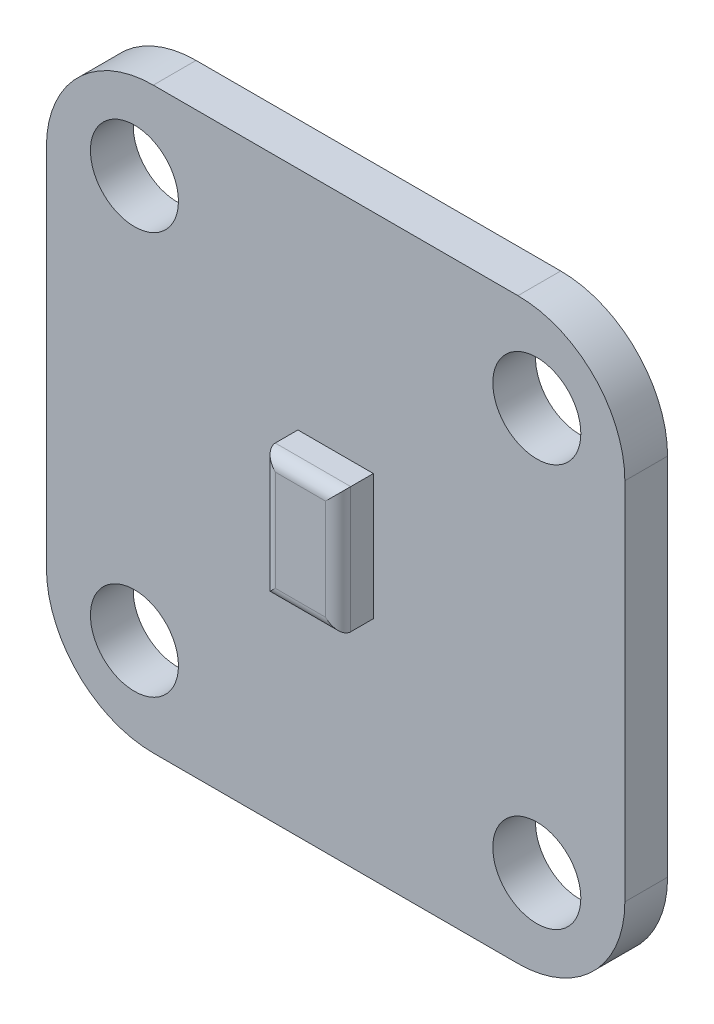
from build123d import *

# Parameters (mm, degrees)
SKETCH_2_W      = 23
SKETCH_2_H      = 23
SKETCH_2_R      = 1.75
EXTRUDE_1_DEPTH = 1.7
SKETCH_2_3_W    = 3
SKETCH_2_3_H    = 5
EXTRUDE_2_DEPTH = 3.1
FILLET_2_R      = 4.25
FILLET_3_R      = 4.25
FILLET_4_R      = 4.25
FILLET_5_R      = 4.25
FILLET_6_R      = 0.5


with BuildPart() as part:
    # 草图2 → 凸台-拉伸1 (new body)
    with BuildSketch(Plane.XY):
        Rectangle(SKETCH_2_W, SKETCH_2_H)
        with Locations((-8, 8)):
            Circle(SKETCH_2_R, mode=Mode.SUBTRACT)
        with Locations((-8, -8)):
            Circle(SKETCH_2_R, mode=Mode.SUBTRACT)
        with Locations((8, -8)):
            Circle(SKETCH_2_R, mode=Mode.SUBTRACT)
        with Locations((8, 8)):
            Circle(SKETCH_2_R, mode=Mode.SUBTRACT)
    extrude(amount=EXTRUDE_1_DEPTH)

    # 草图2<3> → 凸台-拉伸2 (add)
    with BuildSketch(Plane.XY):
        Rectangle(SKETCH_2_3_W, SKETCH_2_3_H)
    extrude(amount=EXTRUDE_2_DEPTH)

    # 圆角2
    fillet_2_edges = [part.edges().sort_by_distance(p)[0] for p in [
        (11.5, 11.5, 0.85),
    ]]
    fillet(fillet_2_edges, radius=FILLET_2_R)

    # 圆角3
    fillet_3_edges = [part.edges().sort_by_distance(p)[0] for p in [
        (-11.5, 11.5, 0.85),
    ]]
    fillet(fillet_3_edges, radius=FILLET_3_R)

    # 圆角4
    fillet_4_edges = [part.edges().sort_by_distance(p)[0] for p in [
        (-11.5, -11.5, 0.85),
    ]]
    fillet(fillet_4_edges, radius=FILLET_4_R)

    # 圆角5
    fillet_5_edges = [part.edges().sort_by_distance(p)[0] for p in [
        (11.5, -11.5, 0.85),
    ]]
    fillet(fillet_5_edges, radius=FILLET_5_R)

    # 圆角6
    fillet_6_edges = [part.edges().sort_by_distance(p)[0] for p in [
        (1.5, 0, 3.1),
        (0, -2.5, 3.1),
        (-1.5, 0, 3.1),
        (0, 2.5, 3.1),
    ]]
    fillet(fillet_6_edges, radius=FILLET_6_R)


solid = part.part
